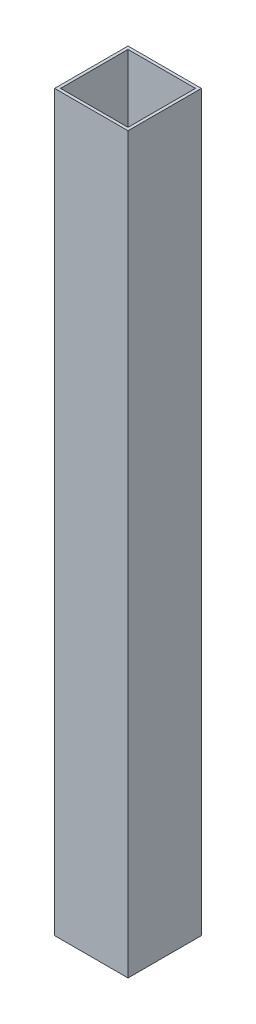
from build123d import *

# Parameters (mm, degrees)
SKETCH1_W           = 50
SKETCH1_H           = 50
SKETCH1_W_2         = 46
SKETCH1_H_2         = 46
BOSS_EXTRUDE1_DEPTH = 500


with BuildPart() as part:
    # Sketch1 → Boss-Extrude1 (new body)
    with BuildSketch(Plane(origin=(0, 0, 0), x_dir=(1, 0, 0), z_dir=(0, 1, 0))):
        Rectangle(SKETCH1_W, SKETCH1_H)
        Rectangle(SKETCH1_W_2, SKETCH1_H_2, mode=Mode.SUBTRACT)
    extrude(amount=BOSS_EXTRUDE1_DEPTH)


solid = part.part
